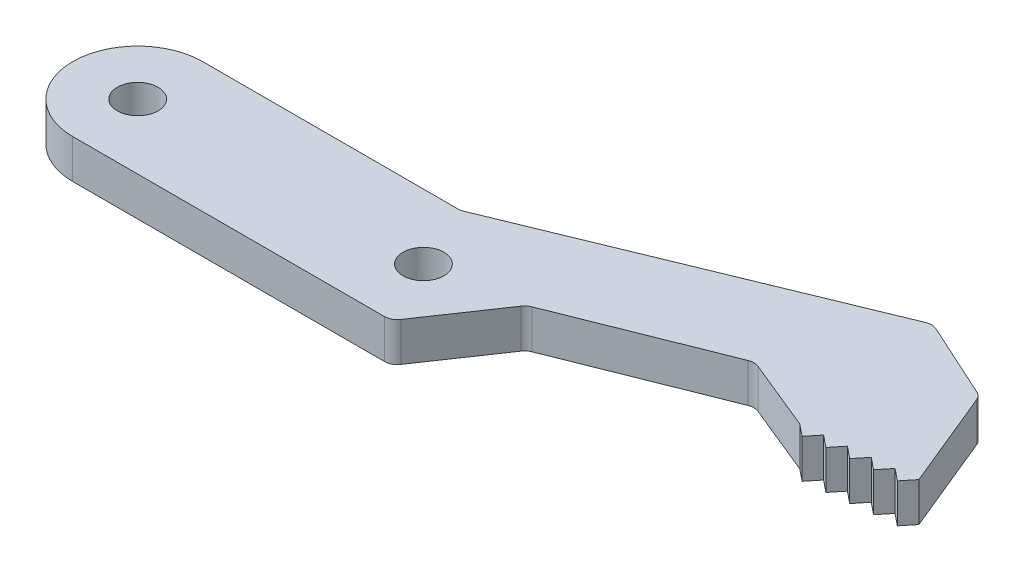
from build123d import *

# Parameters (mm, degrees)
SKETCH1_R           = 1.575
BOSS_EXTRUDE1_DEPTH = 3
L_EK1_SCALE         = 2


with BuildPart() as part:
    # Sketch1 → Boss-Extrude1 (new body)
    with BuildSketch(Plane(origin=(0, 0, 0), x_dir=(1, 0, 0), z_dir=(0, 1, 0))):
        with BuildLine():
            Line((0, -5), (23.998875872, -5))
            ThreePointArc((23.998875872, -5), (24.467345461, -4.883479623), (24.826642543, -4.561072489))
            Line((24.826642543, -4.561072489), (28.564941326, 0.954149161))
            ThreePointArc((28.564941326, 0.954149161), (28.766036178, 1.172359953), (29.022312673, 1.321950886))
            Line((29.022312673, 1.321950886), (40.929553216, 6.070049343))
            ThreePointArc((40.929553216, 6.070049343), (41.304486381, 6.141164834), (41.678758689, 6.066649533))
            Line((41.678758689, 6.066649533), (47.144586244, 3.829406729))
            Line((47.144586244, 3.829406729), (48.06174016, 3.086958957))
            Line((48.06174016, 3.086958957), (48.804187932, 4.004112872))
            Line((48.804187932, 4.004112872), (49.721341848, 3.2616651))
            Line((49.721341848, 3.2616651), (50.46378962, 4.178819016))
            Line((50.46378962, 4.178819016), (51.380943536, 3.436371244))
            Line((51.380943536, 3.436371244), (52.123391308, 4.35352516))
            Line((52.123391308, 4.35352516), (53.040545224, 3.611077387))
            Line((53.040545224, 3.611077387), (53.782992996, 4.528231303))
            Line((53.782992996, 4.528231303), (54.700146912, 3.785783531))
            Line((54.700146912, 3.785783531), (55.442594685, 4.702937447))
            Line((55.442594685, 4.702937447), (52.341745918, 12.244834503))
            ThreePointArc((52.341745918, 12.244834503), (52.137055639, 12.558350103), (51.831402108, 12.774604725))
            Line((51.831402108, 12.774604725), (46.024183924, 15.419882568))
            ThreePointArc((46.024183924, 15.419882568), (45.628323444, 15.509674561), (45.229386093, 15.434727162))
            Line((45.229386093, 15.434727162), (20.032711481, 5.075121772))
            ThreePointArc((20.032711481, 5.075121772), (19.846254378, 5.018960187), (19.652448068, 5))
            Line((19.652448068, 5), (0, 5))
            ThreePointArc((0, 5), (-5, 0), (0, -5))
        make_face()
        with Locations(Location((0, 0, 0), (0, 0, 270))):
            Circle(SKETCH1_R, mode=Mode.SUBTRACT)
        with Locations(Location((22, 0, 0), (0, 0, 270))):
            Circle(SKETCH1_R, mode=Mode.SUBTRACT)
    extrude(amount=BOSS_EXTRUDE1_DEPTH)


with BuildPart() as part_1:
    # Ölçek1: scaled about (24.645515764, 1.5, -3.692559234)
    add(part.part.scale(L_EK1_SCALE).moved(Location((-24.645515764, -1.5, 3.692559234))))


solid = part_1.part
